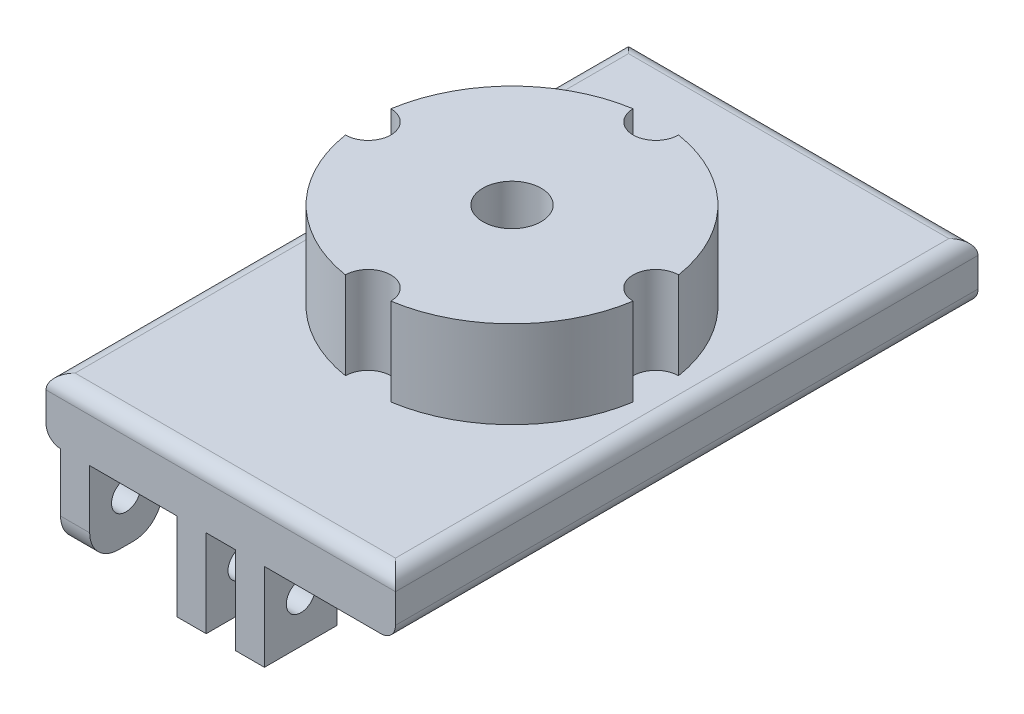
from build123d import *

# Parameters (mm, degrees)
SKETCH_2_W      = 120
SKETCH_2_H      = 200
EXTRUDE_1_DEPTH = 20
EXTRUDE_START   = -7.5
SKETCH_3_R      = 5
EXTRUDE_2_DEPTH = 10
EXTRUDE_START_2 = 5
SKETCH_4_W      = 25
SKETCH_4_H      = 30
SKETCH_4_R      = 5
EXTRUDE_3_DEPTH = 10
EXTRUDE_START_3 = -45
SKETCH_4_2_W    = 25
SKETCH_4_2_H    = 30
SKETCH_4_2_R    = 5
EXTRUDE_4_DEPTH = 10
FILLET_2_R      = 10
FILLET_3_R      = 10
FILLET_4_R      = 5
SKETCH_5_R      = 10
EXTRUDE_5_DEPTH = 30


with BuildPart() as part:
    # 草图2 → 凸台-拉伸1 (new body)
    with BuildSketch(Plane(origin=(0, 0, 0), x_dir=(1, 0, 0), z_dir=(0, 1, 0))):
        Rectangle(SKETCH_2_W, SKETCH_2_H)
    extrude(amount=EXTRUDE_1_DEPTH)

    # 草图3 → 凸台-拉伸2 (add)
    with BuildSketch(Plane(origin=(0, 0, 0), x_dir=(0, 0, -1), z_dir=(1, 0, 0)).offset(EXTRUDE_START)):
        with BuildLine():
            Line((92.070196982, -19.828078793), (100, 0))
            Line((100, 0), (59.999006327, 0))
            Line((59.999006327, 0), (67.929286029, -19.828285561))
            ThreePointArc((67.929286029, -19.828285561), (79.999811504, -28.000749672), (92.070196982, -19.828078793))
        make_face()
        with Locations((79.999700158, -15.000749673)):
            Circle(SKETCH_3_R, mode=Mode.SUBTRACT)
    extrude(amount=-EXTRUDE_2_DEPTH)

    # 草图4 → 凸台-拉伸3 (add)
    with BuildSketch(Plane(origin=(0, 0, 0), x_dir=(0, 0, -1), z_dir=(1, 0, 0)).offset(EXTRUDE_START_2)):
        with Locations((-87.5, -15)):
            Rectangle(SKETCH_4_W, SKETCH_4_H)
        with Locations((-87.5, -15)):
            Circle(SKETCH_4_R, mode=Mode.SUBTRACT)
    extrude_3 = extrude(amount=EXTRUDE_3_DEPTH)

    # 镜向1: 凸台-拉伸3 across plane
    add(extrude_3.mirror(Plane(origin=(0, 0, 0), x_dir=(0, 0, 1), z_dir=(1, 0, 0))))

    # 草图4<2> → 凸台-拉伸4 (add)
    with BuildSketch(Plane(origin=(0, 0, 0), x_dir=(0, 0, -1), z_dir=(1, 0, 0)).offset(EXTRUDE_START_3)):
        with Locations((-87.5, -15)):
            Rectangle(SKETCH_4_2_W, SKETCH_4_2_H)
        with Locations((-87.5, -15)):
            Circle(SKETCH_4_2_R, mode=Mode.SUBTRACT)
    extrude(amount=-EXTRUDE_4_DEPTH)

    # 圆角2
    fillet_2_edges = [part.edges().sort_by_distance(p)[0] for p in [
        (-50, -30, 100),
    ]]
    fillet(fillet_2_edges, radius=FILLET_2_R)

    # 圆角3
    fillet_3_edges = [part.edges().sort_by_distance(p)[0] for p in [
        (-50, -30, 75),
    ]]
    fillet(fillet_3_edges, radius=FILLET_3_R)

    # 圆角4
    fillet_4_edges = [part.edges().sort_by_distance(p)[0] for p in [
        (60, 0, 0),
        (-60, 0, 0),
        (0, 20, 100),
        (-60, 20, 0),
        (0, 20, -100),
        (60, 20, 0),
    ]]
    fillet(fillet_4_edges, radius=FILLET_4_R)

    # 草图5 → 凸台-拉伸5 (add)
    with BuildSketch(Plane(origin=(0, 20, 0), x_dir=(1, 0, 0), z_dir=(0, 1, 0))):
        with BuildLine():
            ThreePointArc((49.388864588, -7.793590617), (41.595273971, 0), (49.388864588, 7.793590617))
            ThreePointArc((49.388864588, 7.793590617), (35.355339059, 35.355339059), (7.793590617, 49.388864588))
            ThreePointArc((7.793590617, 49.388864588), (0, 41.595273971), (-7.793590617, 49.388864588))
            ThreePointArc((-7.793590617, 49.388864588), (-35.355339059, 35.355339059), (-49.388864588, 7.793590617))
            ThreePointArc((-49.388864588, 7.793590617), (-41.595273971, 0), (-49.388864588, -7.793590617))
            ThreePointArc((-49.388864588, -7.793590617), (-35.355339059, -35.355339059), (-7.793590617, -49.388864588))
            ThreePointArc((-7.793590617, -49.388864588), (0, -41.595273971), (7.793590617, -49.388864588))
            ThreePointArc((7.793590617, -49.388864588), (35.355339059, -35.355339059), (49.388864588, -7.793590617))
        make_face()
        Circle(SKETCH_5_R, mode=Mode.SUBTRACT)
    extrude(amount=EXTRUDE_5_DEPTH)


solid = part.part
